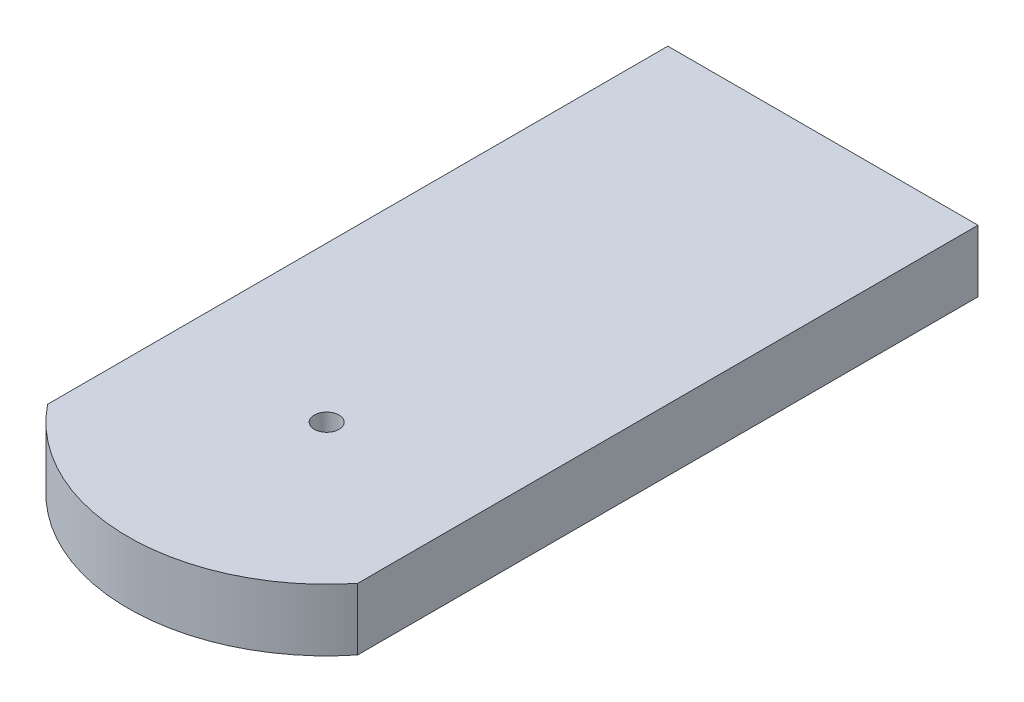
from build123d import *

# Parameters (mm, degrees)
SKETCH1_W           = 50
SKETCH1_H           = 100
SKETCH1_R           = 2
BOSS_EXTRUDE1_DEPTH = 10


with BuildPart() as part:
    # Sketch1 → Boss-Extrude1 (new body)
    # profile 1 of 2: a face of its own
    with BuildSketch(Plane(origin=(0, 0, 0), x_dir=(1, 0, 0), z_dir=(0, 1, 0))):
        Rectangle(SKETCH1_W, SKETCH1_H)
        with Locations(Location((0, -30, 0), (0, 0, 270))):
            Circle(SKETCH1_R, mode=Mode.SUBTRACT)
    # profile 2 of 2: a face of its own
    with BuildSketch(Plane(origin=(0, 0, 0), x_dir=(1, 0, 0), z_dir=(0, 1, 0))):
        with BuildLine():
            Line((-25, -50), (25, -50))
            ThreePointArc((25, -50), (0, -62.015621187), (-25, -50))
        make_face()
    extrude(amount=BOSS_EXTRUDE1_DEPTH)


solid = part.part
